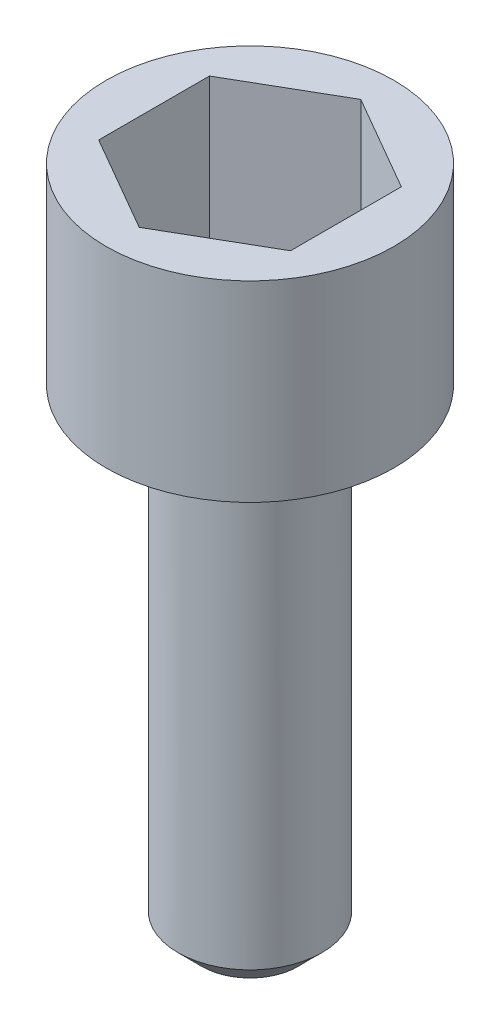
from build123d import *

# Parameters (mm, degrees)
CUT_EXTRUDE1_DEPTH = 3
CHAMFER1_SIZE      = 0.5


with BuildPart() as part:
    # Sketch1 → Revolve1 (revolve)
    with BuildSketch(Plane.XY, mode=Mode.PRIVATE) as revolve1_sk:
        Polygon((0, 14), (-3, 14), (-3, 10), (-1.5, 10), (-1.5, 0), (0, 0), align=None)
    revolve(revolve1_sk.sketch.rotate(Axis((0, 0, 0), (0, 1, 0)), 270), axis=Axis((0, 0, 0), (0, 1, 0)))

    # Sketch2 → Cut-Extrude1 (cut)
    with BuildSketch(Plane(origin=(0, 14, 0), x_dir=(1, 0, 0), z_dir=(0, 1, 0))):
        Polygon((0, 2.309401077), (-2, 1.154700538), (-2, -1.154700538), (0, -2.309401077), (2, -1.154700538), (2, 1.154700538), align=None)
    extrude(amount=-CUT_EXTRUDE1_DEPTH, mode=Mode.SUBTRACT)

    # Chamfer1
    chamfer1_edges = [part.edges().sort_by_distance(p)[0] for p in [
        (0, 0, 1.5),
    ]]
    chamfer(chamfer1_edges, length=CHAMFER1_SIZE)


solid = part.part
